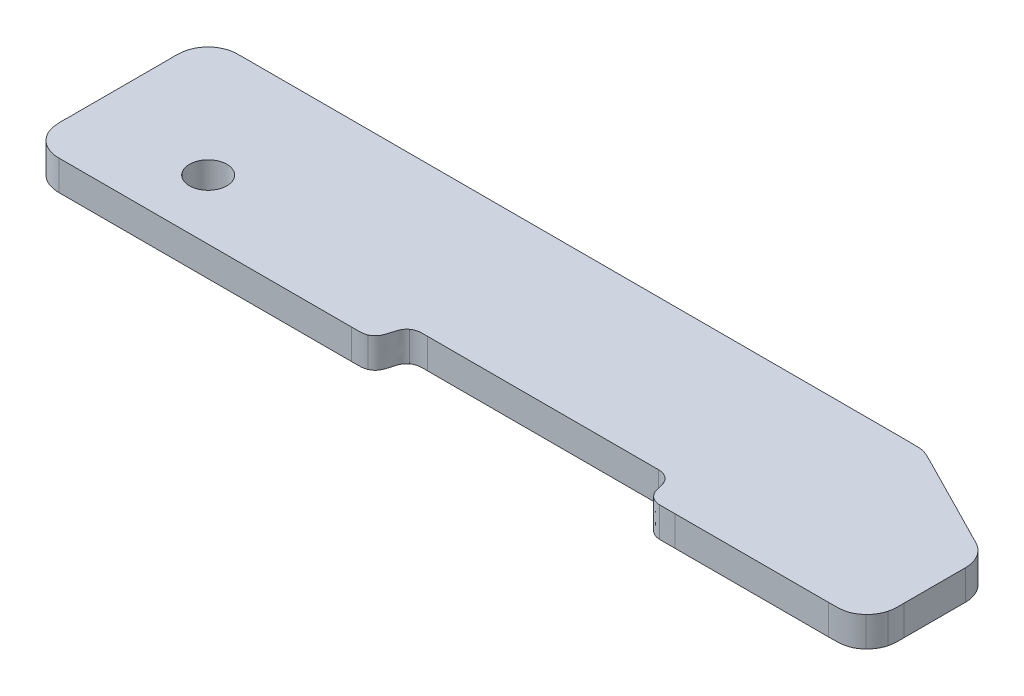
from build123d import *

# Parameters (mm, degrees)
SKETCH4_R           = 3.96875
BOSS_EXTRUDE1_DEPTH = 6.35


with BuildPart() as part:
    # Sketch4 → Boss-Extrude1 (new body)
    with BuildSketch(Plane(origin=(0, 0, 0), x_dir=(1, 0, 0), z_dir=(0, 1, 0))):
        with BuildLine():
            add(Edge.make_bspline(
                [(157.3945036, 35.575748), (161.28746, 33.591373), (165.173533, 31.6138814), (169.0664894, 29.6295064)],
                knots=[0, 0, 0, 0, 1, 1, 1, 1], degree=3))
            add(Edge.make_bspline(
                [(169.0664894, 29.6295064), (170.038014, 29.1333936), (171.0095386, 28.6373062), (171.9810378, 28.1412188)],
                knots=[0, 0, 0, 0, 1, 1, 1, 1], degree=3))
            add(Edge.make_bspline(
                [(171.9810378, 28.1412188), (172.9525624, 27.6520148), (173.9378538, 27.1972786), (174.8818194, 26.6529312)],
                knots=[0, 0, 0, 0, 1, 1, 1, 1], degree=3))
            add(Edge.make_bspline(
                [(174.8818194, 26.6529312), (176.845674168, 25.522871997), (178.058382888, 23.42110905), (178.058190977, 21.154029732)],
                knots=[0, 0, 0, 0, 1.00007912, 1.00007912, 1.00007912, 1.00007912], degree=3))
            add(Edge.make_bspline(
                [(178.058190977, 21.154029732), (178.057823515, 16.813399333), (178.05745549, 12.46586099), (178.057087466, 8.118322647)],
                knots=[4.1319e-05, 4.1319e-05, 4.1319e-05, 4.1319e-05, 1, 1, 1, 1], degree=3))
            add(Edge.make_bspline(
                [(178.057087466, 8.118322647), (178.057457698, 7.050328911), (178.126784145, 5.99615128), (177.8376936, 4.934966)],
                knots=[0, 0, 0, 0, 1, 1, 1, 1], degree=3))
            add(Edge.make_bspline(
                [(177.8376936, 4.934966), (177.5207524, 3.7567616), (176.9764304, 2.8472638), (176.101375, 1.9997674)],
                knots=[0, 0, 0, 0, 1, 1, 1, 1], degree=3))
            add(Edge.make_bspline(
                [(176.101375, 1.9997674), (174.117, 0.1049528), (172.3462136, 0.2358644), (169.9208692, 0.2358644)],
                knots=[0, 0, 0, 0, 1, 1, 1, 1], degree=3))
            add(Edge.make_bspline(
                [(169.9208692, 0.2358644), (161.232342, 0.2358644), (152.5369314, 0.2358644), (143.8483788, 0.2358644)],
                knots=[0, 0, 0, 0, 1, 1, 1, 1], degree=3))
            add(Edge.make_bspline(
                [(143.8483788, 0.2358644), (141.664182, 0.2358644), (139.486894, 0.2358644), (137.309606, 0.2358644)],
                knots=[0, 0, 0, 0, 1, 1, 1, 1], degree=3))
            add(Edge.make_bspline(
                [(137.309606, 0.2358644), (136.2209366, 0.2358644), (135.139176, 0.2013712), (134.050532, 0.2358644)],
                knots=[0, 0, 0, 0, 1, 1, 1, 1], degree=3))
            add(Edge.make_bspline(
                [(134.050532, 0.2358644), (132.8998866, 0.2703576), (131.8594518, 0.9180068), (131.3288966, 1.9377406)],
                knots=[0, 0, 0, 0, 1, 1, 1, 1], degree=3))
            add(Edge.make_bspline(
                [(131.3288966, 1.9377406), (130.8190424, 2.9161486), (130.8810692, 4.0323516), (130.3160462, 5.0038762)],
                knots=[0, 0, 0, 0, 1, 1, 1, 1], degree=3))
            add(Edge.make_bspline(
                [(130.3160462, 5.0038762), (129.7372818, 6.0029598), (128.6830802, 6.5817496), (127.5324094, 6.5817496)],
                knots=[0, 0, 0, 0, 1, 1, 1, 1], degree=3))
            add(Edge.make_bspline(
                [(127.5324094, 6.5817496), (125.3551214, 6.5817496), (123.177808, 6.5817496), (121.00052, 6.5817496)],
                knots=[0, 0, 0, 0, 1, 1, 1, 1], degree=3))
            add(Edge.make_bspline(
                [(121.00052, 6.5817496), (112.2844084, 6.5817496), (103.575231, 6.5817496), (94.8591194, 6.5817496)],
                knots=[0, 0, 0, 0, 1, 1, 1, 1], degree=3))
            add(Edge.make_bspline(
                [(94.8591194, 6.5817496), (90.504518, 6.5817496), (86.1430332, 6.5817496), (81.7815484, 6.5817496)],
                knots=[0, 0, 0, 0, 1, 1, 1, 1], degree=3))
            add(Edge.make_bspline(
                [(81.7815484, 6.5817496), (80.6929044, 6.5817496), (79.604235, 6.5817496), (78.515591, 6.5817496)],
                knots=[0, 0, 0, 0, 1, 1, 1, 1], degree=3))
            add(Edge.make_bspline(
                [(78.515591, 6.5817496), (77.399388, 6.5817496), (76.3727454, 6.7194938), (75.3461028, 5.9685174)],
                knots=[0, 0, 0, 0, 1, 1, 1, 1], degree=3))
            add(Edge.make_bspline(
                [(75.3461028, 5.9685174), (73.37552, 4.5284644), (74.5055152, 1.6759174), (71.963026, 0.5183632)],
                knots=[0, 0, 0, 0, 1, 1, 1, 1], degree=3))
            add(Edge.make_bspline(
                [(71.963026, 0.5183632), (71.122413, 0.1325118), (69.572124, 0.2358644), (68.7315364, 0.2358644)],
                knots=[0, 0, 0, 0, 1, 1, 1, 1], degree=3))
            add(Edge.make_bspline(
                [(68.7315364, 0.2358644), (67.642867, 0.2358644), (66.554223, 0.2358644), (65.465579, 0.2358644)],
                knots=[0, 0, 0, 0, 1, 1, 1, 1], degree=3))
            add(Edge.make_bspline(
                [(65.465579, 0.2358644), (63.2882656, 0.2358644), (61.1040942, 0.2358644), (58.9267808, 0.2358644)],
                knots=[0, 0, 0, 0, 1, 1, 1, 1], degree=3))
            add(Edge.make_bspline(
                [(58.9267808, 0.2358644), (54.565296, 0.2358644), (50.2106946, 0.2358644), (45.8492098, 0.2358644)],
                knots=[0, 0, 0, 0, 1, 1, 1, 1], degree=3))
            add(Edge.make_bspline(
                [(45.8492098, 0.2358644), (37.1537738, 0.2358644), (28.4514798, 0.2358644), (19.7491604, 0.2358644)],
                knots=[0, 0, 0, 0, 1, 1, 1, 1], degree=3))
            add(Edge.make_bspline(
                [(19.7491604, 0.2358644), (15.4014424, 0.2358644), (11.046841, 0.2358644), (6.699123, 0.2358644)],
                knots=[0, 0, 0, 0, 1, 1, 1, 1], degree=3))
            add(Edge.make_bspline(
                [(6.699123, 0.2358644), (4.3633644, 0.2358644), (2.2618446, 1.3865352), (1.0905236, 3.4329116)],
                knots=[0, 0, 0, 0, 1, 1, 1, 1], degree=3))
            add(Edge.make_bspline(
                [(1.0905236, 3.4329116), (-0.0325882, 5.4035198), (0.256794, 7.8081886), (0.256794, 9.8201226)],
                knots=[0, 0, 0, 0, 1, 1, 1, 1], degree=3))
            add(Edge.make_bspline(
                [(0.256794, 9.8201226), (0.256794, 14.1678406), (0.256794, 18.5155586), (0.256794, 22.8563678)],
                knots=[0, 0, 0, 0, 1, 1, 1, 1], degree=3))
            add(Edge.make_bspline(
                [(0.256794, 22.8563678), (0.256794, 25.0336558), (0.256794, 27.2040858), (0.256794, 29.3744904)],
                knots=[0, 0, 0, 0, 1, 1, 1, 1], degree=3))
            add(Edge.make_bspline(
                [(0.256794, 29.3744904), (0.256794, 31.600013), (-0.0118872, 33.6464148), (1.4832584, 35.6859078)],
                knots=[0, 0, 0, 0, 1, 1, 1, 1], degree=3))
            add(Edge.make_bspline(
                [(1.4832584, 35.6859078), (2.21361, 36.6849914), (3.0611064, 37.3464328), (4.197985, 37.8149866)],
                knots=[0, 0, 0, 0, 1, 1, 1, 1], degree=3))
            add(Edge.make_bspline(
                [(4.197985, 37.8149866), (5.2453032, 38.2421892), (6.2788292, 38.2834896), (7.3674732, 38.2834896)],
                knots=[0, 0, 0, 0, 1, 1, 1, 1], degree=3))
            add(Edge.make_bspline(
                [(7.3674732, 38.2834896), (9.5379032, 38.2834896), (11.7083078, 38.2834896), (13.8855958, 38.2834896)],
                knots=[0, 0, 0, 0, 1, 1, 1, 1], degree=3))
            add(Edge.make_bspline(
                [(13.8855958, 38.2834896), (18.2264304, 38.2834896), (22.574123, 38.2834896), (26.921841, 38.2834896)],
                knots=[0, 0, 0, 0, 1, 1, 1, 1], degree=3))
            add(Edge.make_bspline(
                [(26.921841, 38.2834896), (44.4091568, 38.2834896), (61.8964472, 38.2834896), (79.3906464, 38.2834896)],
                knots=[0, 0, 0, 0, 1, 1, 1, 1], degree=3))
            add(Edge.make_bspline(
                [(79.3906464, 38.2834896), (96.8572866, 38.2834896), (114.3308102, 38.2834896), (131.7974504, 38.2834896)],
                knots=[0, 0, 0, 0, 1, 1, 1, 1], degree=3))
            add(Edge.make_bspline(
                [(131.7974504, 38.2834896), (136.1589352, 38.2834896), (140.5273034, 38.2834896), (144.8888136, 38.2834896)],
                knots=[0, 0, 0, 0, 1, 1, 1, 1], degree=3))
            add(Edge.make_bspline(
                [(144.8888136, 38.2834896), (145.4744614, 38.2834896), (150.8419386, 38.3039874), (151.4344952, 38.2215898)],
                knots=[0, 0, 0, 0, 1, 1, 1, 1], degree=3))
            add(Edge.make_bspline(
                [(151.4344952, 38.2215898), (152.5644904, 38.0630176), (153.5015472, 37.560123), (154.4799552, 37.0571268)],
                knots=[0, 0, 0, 0, 1, 1, 1, 1], degree=3))
            add(Edge.make_bspline(
                [(154.4799552, 37.0571268), (155.4514798, 36.5679228), (156.422979, 36.0718354), (157.3945036, 35.575748)],
                knots=[0, 0, 0, 0, 1, 1, 1, 1], degree=3))
        make_face()
        with Locations(Location((25.6540508, 12.9344928, 0), (0, 0, 270))):
            Circle(SKETCH4_R, mode=Mode.SUBTRACT)
    extrude(amount=BOSS_EXTRUDE1_DEPTH)


solid = part.part
